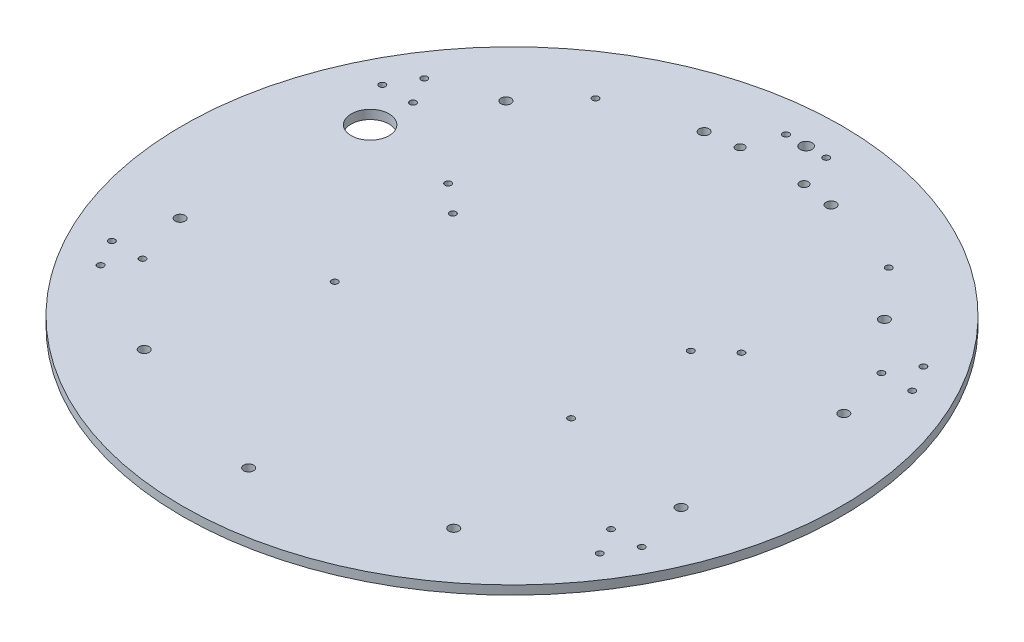
from build123d import *

# Parameters (mm, degrees)
SKETCH1_R         = 177
PLATE_DEPTH       = 4.7625
SKETCH2_R         = 1.7
STANDOFFS_DEPTH   = 251.361102023
SKETCH3_R         = 1.7
LIDAR_DEPTH       = 251.361102023
SKETCH4_R         = 2.286
CAMERA_DEPTH      = 251.361102023
SKETCH5_R         = 1.7
DISPLAY_DEPTH     = 251.361102023
SKETCH6_R         = 10.16
WIRES_2_DEPTH     = 251.361102023
SKETCH7_R         = 3.175
SKETCH7_R_2       = 1.7
ARDUCAM_DEPTH     = 251.361102023
ZIPTIE_DEPTH      = 251.361102023
ZIPTIE_DEPTH_BACK = 251.361102023
SKETCH8_R         = 2.667


with BuildPart() as part:
    # Sketch1 → Plate (new body)
    with BuildSketch(Plane(origin=(0, 0, 0), x_dir=(1, 0, 0), z_dir=(0, 1, 0))):
        with Locations(Location((0, 0, 0), (0, 0, 90))):
            Circle(SKETCH1_R)
    extrude(amount=PLATE_DEPTH)

    # Sketch2 → Standoffs (cut, through all)
    with BuildSketch(Plane(origin=(0, 4.7625, 0), x_dir=(1, 0, 0), z_dir=(0, 1, 0))):
        with Locations(Location((134.039081871, -86.9125, 0), (0, 0, 270))):
            Circle(SKETCH2_R)
        with Locations(Location((125.7901899, -72.625, 0), (0, 0, 270))):
            Circle(SKETCH2_R)
        with Locations(Location((142.287973842, -72.625, 0), (0, 0, 270))):
            Circle(SKETCH2_R)
        with Locations(Location((-142.287973842, -72.625, 0), (0, 0, 270))):
            Circle(SKETCH2_R)
        with Locations(Location((-125.7901899, -72.625, 0), (0, 0, 270))):
            Circle(SKETCH2_R)
        with Locations(Location((-134.039081871, -86.9125, 0), (0, 0, 270))):
            Circle(SKETCH2_R)
        with Locations(Location((-134.039081871, 86.9125, 0), (0, 0, 270))):
            Circle(SKETCH2_R)
        with Locations(Location((-125.7901899, 72.625, 0), (0, 0, 270))):
            Circle(SKETCH2_R)
        with Locations(Location((-142.287973842, 72.625, 0), (0, 0, 270))):
            Circle(SKETCH2_R)
        with Locations(Location((142.287973842, 72.625, 0), (0, 0, 270))):
            Circle(SKETCH2_R)
        with Locations(Location((125.7901899, 72.625, 0), (0, 0, 270))):
            Circle(SKETCH2_R)
        with Locations(Location((134.039081871, 86.9125, 0), (0, 0, 270))):
            Circle(SKETCH2_R)
    extrude(amount=-STANDOFFS_DEPTH, mode=Mode.SUBTRACT)

    # Sketch3 → LIDAR (cut, through all)
    with BuildSketch(Plane(origin=(0, 4.7625, 0), x_dir=(1, 0, 0), z_dir=(0, 1, 0))):
        with Locations(Location((64.276474969, 31.75, 0), (0, 0, 270))):
            Circle(SKETCH3_R)
        with Locations(Location((-63.5, 31.75, 0), (0, 0, 270))):
            Circle(SKETCH3_R)
        with Locations(Location((-63.5, -31.75, 0), (0, 0, 270))):
            Circle(SKETCH3_R)
        with Locations(Location((63.5, -31.745252473, 0), (0, 0, 270))):
            Circle(SKETCH3_R)
    extrude(amount=-LIDAR_DEPTH, mode=Mode.SUBTRACT)

    # Sketch4 → Camera (cut, through all)
    with BuildSketch(Plane(origin=(0, 4.7625, 0), x_dir=(1, 0, 0), z_dir=(0, 1, 0))):
        with Locations(Location((-17.145, 139.7, 0), (0, 0, 270))):
            Circle(SKETCH4_R)
        with Locations(Location((17.145, 139.7, 0), (0, 0, 270))):
            Circle(SKETCH4_R)
    extrude(amount=-CAMERA_DEPTH, mode=Mode.SUBTRACT)

    # Sketch5 → Display (cut, through all)
    with BuildSketch(Plane(origin=(0, 4.7625, 0), x_dir=(1, 0, 0), z_dir=(0, 1, 0))):
        with Locations(Location((78.74500001, 123.61, 0), (0, 0, 270))):
            Circle(SKETCH5_R)
        with Locations(Location((-78.74499999, 123.61, 0), (0, 0, 270))):
            Circle(SKETCH5_R)
        with Locations(Location((78.74500001, 44.45, 0), (0, 0, 270))):
            Circle(SKETCH5_R)
        with Locations(Location((-78.74499999, 44.45, 0), (0, 0, 270))):
            Circle(SKETCH5_R)
    extrude(amount=-DISPLAY_DEPTH, mode=Mode.SUBTRACT)

    # Sketch6 → Wires 2 (cut, through all)
    with BuildSketch(Plane(origin=(0, 4.7625, 0), x_dir=(1, 0, 0), z_dir=(0, 1, 0))):
        with Locations(Location((-127, 50.8, 0), (0, 0, 270))):
            Circle(SKETCH6_R)
    extrude(amount=-WIRES_2_DEPTH, mode=Mode.SUBTRACT)

    # Sketch7 → Arducam (cut, through all)
    with BuildSketch(Plane(origin=(0, 4.7625, 0), x_dir=(1, 0, 0), z_dir=(0, 1, 0))):
        with Locations(Location((0, 157.95, 0), (0, 0, 270))):
            Circle(SKETCH7_R)
        with Locations(Location((-10.795, 157.95, 0), (0, 0, 270))):
            Circle(SKETCH7_R_2)
        with Locations(Location((10.795, 157.95, 0), (0, 0, 270))):
            Circle(SKETCH7_R_2)
    extrude(amount=-ARDUCAM_DEPTH, mode=Mode.SUBTRACT)

    # Sketch8 → Ziptie (cut, two sides: drawn at the far end of the back side and taken through both)
    with BuildSketch(Plane(origin=(0, 4.7625, 0), x_dir=(1, 0, 0), z_dir=(0, 1, 0)).offset(-ZIPTIE_DEPTH_BACK)):
        with Locations(Location((0, -141.439999949, 0), (0, 0, 270))):
            Circle(SKETCH8_R)
        with Locations(Location((-83.136346054, -114.427363643, 0), (0, 0, 270))):
            Circle(SKETCH8_R)
        with Locations(Location((-134.517433616, -43.707363669, 0), (0, 0, 270))):
            Circle(SKETCH8_R)
        with Locations(Location((134.517433616, 43.707363669, 0), (0, 0, 270))):
            Circle(SKETCH8_R)
        with Locations(Location((134.517433616, -43.707363669, 0), (0, 0, 270))):
            Circle(SKETCH8_R)
        with Locations(Location((83.136346054, -114.427363643, 0), (0, 0, 270))):
            Circle(SKETCH8_R)
        with Locations(Location((-101.628042455, 98.371818051, 0), (0, 0, 270))):
            Circle(SKETCH8_R)
        with Locations(Location((-34.100478647, 137.267734578, 0), (0, 0, 270))):
            Circle(SKETCH8_R)
        with Locations(Location((101.628042455, 98.371818051, 0), (0, 0, 270))):
            Circle(SKETCH8_R)
        with Locations(Location((34.100478647, 137.267734578, 0), (0, 0, 270))):
            Circle(SKETCH8_R)
    extrude(amount=ZIPTIE_DEPTH + ZIPTIE_DEPTH_BACK, mode=Mode.SUBTRACT)


solid = part.part
